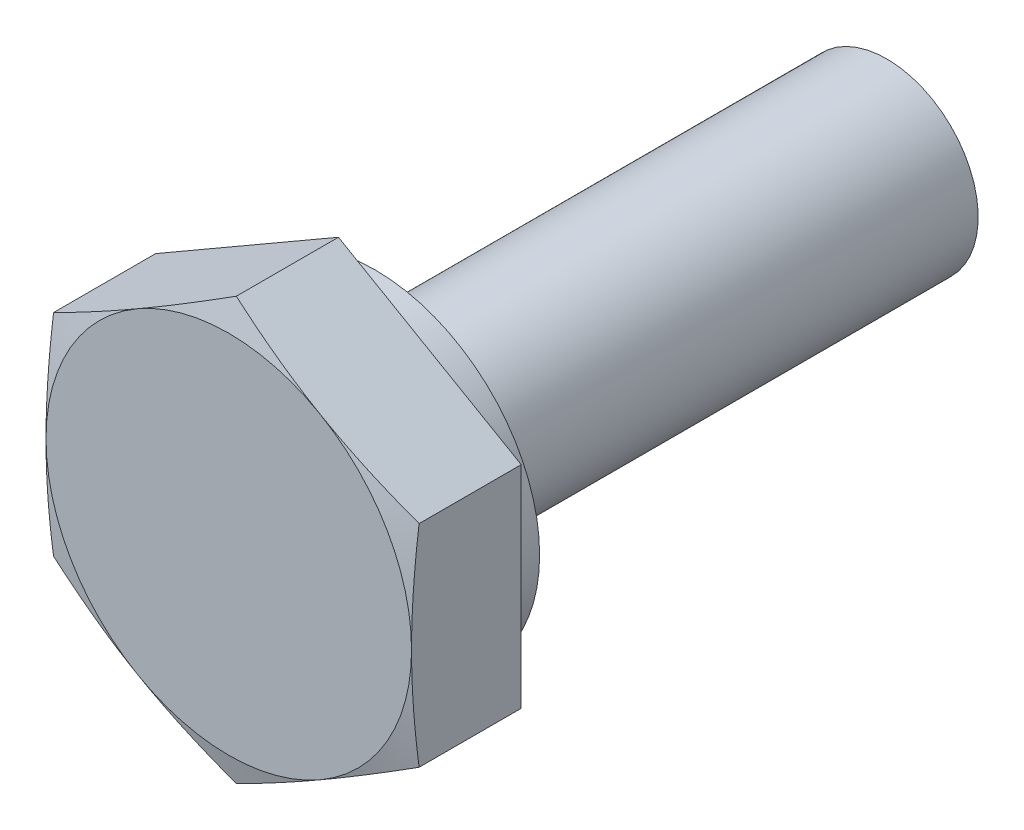
from build123d import *

# Parameters (mm, degrees)
RESSALTO_EXTRUS_O3_DEPTH = 4
ESBO_O5_OUTSIDE_W        = 112.192
ESBO_O5_OUTSIDE_H        = 113.74
ESBO_O5_OUTSIDE_R        = 5.562980719
CORTE_EXTRUS_O4_DEPTH    = 13
CORTE_EXTRUS_O4_DRAFT    = -75
ESBO_O6_OUTSIDE_W        = 112.192
ESBO_O6_OUTSIDE_H        = 113.74
ESBO_O6_OUTSIDE_R        = 5.467270474
CORTE_EXTRUS_O5_DEPTH    = 13
CORTE_EXTRUS_O5_DRAFT    = -75
ESBO_O7_R                = 2.5
RESSALTO_EXTRUS_O4_DEPTH = 14
ESBO_O8_OUTSIDE_W        = 128.684
ESBO_O8_OUTSIDE_H        = 130.232
ESBO_O8_OUTSIDE_R        = 5
CORTE_EXTRUS_O6_DEPTH    = 15
CORTE_EXTRUS_O6_DRAFT    = -75
ESBO_O9_OUTSIDE_W        = 16.722
ESBO_O9_OUTSIDE_H        = 18.27
ESBO_O9_OUTSIDE_R        = 4.503145179
CORTE_EXTRUS_O7_DEPTH    = 1


with BuildPart() as part:
    # Esboço1 → Ressalto-extrusão3 (new body)
    with BuildSketch(Plane.XY):
        Polygon((0, 5.773502692), (-5, 2.886751346), (-5, -2.886751346), (0, -5.773502692), (5, -2.886751346), (5, 2.886751346), align=None)
    extrude(amount=RESSALTO_EXTRUS_O3_DEPTH)


with BuildPart() as corte_extrus_o4_tool:
    # Esboço5 outside → Corte-extrusão4 (with draft: the straight prism first)
    with BuildSketch(Plane.XY.offset(4)):
        Rectangle(ESBO_O5_OUTSIDE_W, ESBO_O5_OUTSIDE_H)
        with Locations((-0.125961439, 0)):
            Circle(ESBO_O5_OUTSIDE_R, mode=Mode.SUBTRACT)
    extrude(amount=-CORTE_EXTRUS_O4_DEPTH)
    # Corte-extrusão4: the draft: its side faces are tilted about the plane it starts from
    corte_extrus_o4_sides = [corte_extrus_o4_tool.faces().sort_by_distance(p)[0] for p in [
        (0, -56.87, -2.5),
        (56.096, 0, -2.5),
        (0, 56.87, -2.5),
        (-56.096, 0, -2.5),
        (-5.688942158, 0, -2.5),
    ]]
    draft(corte_extrus_o4_sides, Plane.XY.offset(4), CORTE_EXTRUS_O4_DRAFT)


with BuildPart() as part_1:
    add(part.part)

    # Corte-extrusão4: cut by corte_extrus_o4_tool
    add(corte_extrus_o4_tool.part, mode=Mode.SUBTRACT)


with BuildPart() as corte_extrus_o5_tool:
    # Esboço6 outside → Corte-extrusão5 (with draft: the straight prism first)
    with BuildSketch(Plane(origin=(0, 0, 0), x_dir=(-1, 0, 0), z_dir=(0, 0, -1))):
        Rectangle(ESBO_O6_OUTSIDE_W, ESBO_O6_OUTSIDE_H)
        Circle(ESBO_O6_OUTSIDE_R, mode=Mode.SUBTRACT)
    extrude(amount=-CORTE_EXTRUS_O5_DEPTH)
    # Corte-extrusão5: the draft: its side faces are tilted about the plane it starts from
    corte_extrus_o5_sides = [corte_extrus_o5_tool.faces().sort_by_distance(p)[0] for p in [
        (0, -56.87, 6.5),
        (-56.096, 0, 6.5),
        (0, 56.87, 6.5),
        (56.096, 0, 6.5),
        (5.467270474, 0, 6.5),
    ]]
    draft(corte_extrus_o5_sides, Plane(origin=(0, 0, 0), x_dir=(-1, 0, 0), z_dir=(0, 0, -1)), CORTE_EXTRUS_O5_DRAFT)


with BuildPart() as part_2:
    add(part_1.part)

    # Corte-extrusão5: cut by corte_extrus_o5_tool
    add(corte_extrus_o5_tool.part, mode=Mode.SUBTRACT)


with BuildPart() as body_2:
    # Esboço7 → Ressalto-extrusão4 (new body)
    with BuildSketch(Plane(origin=(0, 0, 0), x_dir=(-1, 0, 0), z_dir=(0, 0, -1))):
        Circle(ESBO_O7_R)
    extrude(amount=RESSALTO_EXTRUS_O4_DEPTH)


with BuildPart() as corte_extrus_o6_tool:
    # Esboço8 outside → Corte-extrusão6 (with draft: the straight prism first)
    with BuildSketch(Plane.XY.offset(4)):
        Rectangle(ESBO_O8_OUTSIDE_W, ESBO_O8_OUTSIDE_H)
        Circle(ESBO_O8_OUTSIDE_R, mode=Mode.SUBTRACT)
    extrude(amount=-CORTE_EXTRUS_O6_DEPTH)
    # Corte-extrusão6: the draft: its side faces are tilted about the plane it starts from
    corte_extrus_o6_sides = [corte_extrus_o6_tool.faces().sort_by_distance(p)[0] for p in [
        (0, -65.116, -3.5),
        (64.342, 0, -3.5),
        (0, 65.116, -3.5),
        (-64.342, 0, -3.5),
        (-5, 0, -3.5),
    ]]
    draft(corte_extrus_o6_sides, Plane.XY.offset(4), CORTE_EXTRUS_O6_DRAFT)


with BuildPart() as part_3:
    add(part_2.part)

    # Corte-extrusão6: cut by corte_extrus_o6_tool
    add(corte_extrus_o6_tool.part, mode=Mode.SUBTRACT)

    # Esboço9 outside → Corte-extrusão7 (cut)
    with BuildSketch(Plane(origin=(0, 0, 0), x_dir=(-1, 0, 0), z_dir=(0, 0, -1))):
        Rectangle(ESBO_O9_OUTSIDE_W, ESBO_O9_OUTSIDE_H)
        Circle(ESBO_O9_OUTSIDE_R, mode=Mode.SUBTRACT)
    extrude(amount=-CORTE_EXTRUS_O7_DEPTH, mode=Mode.SUBTRACT)


solid = Compound([body_2.part, part_3.part])
